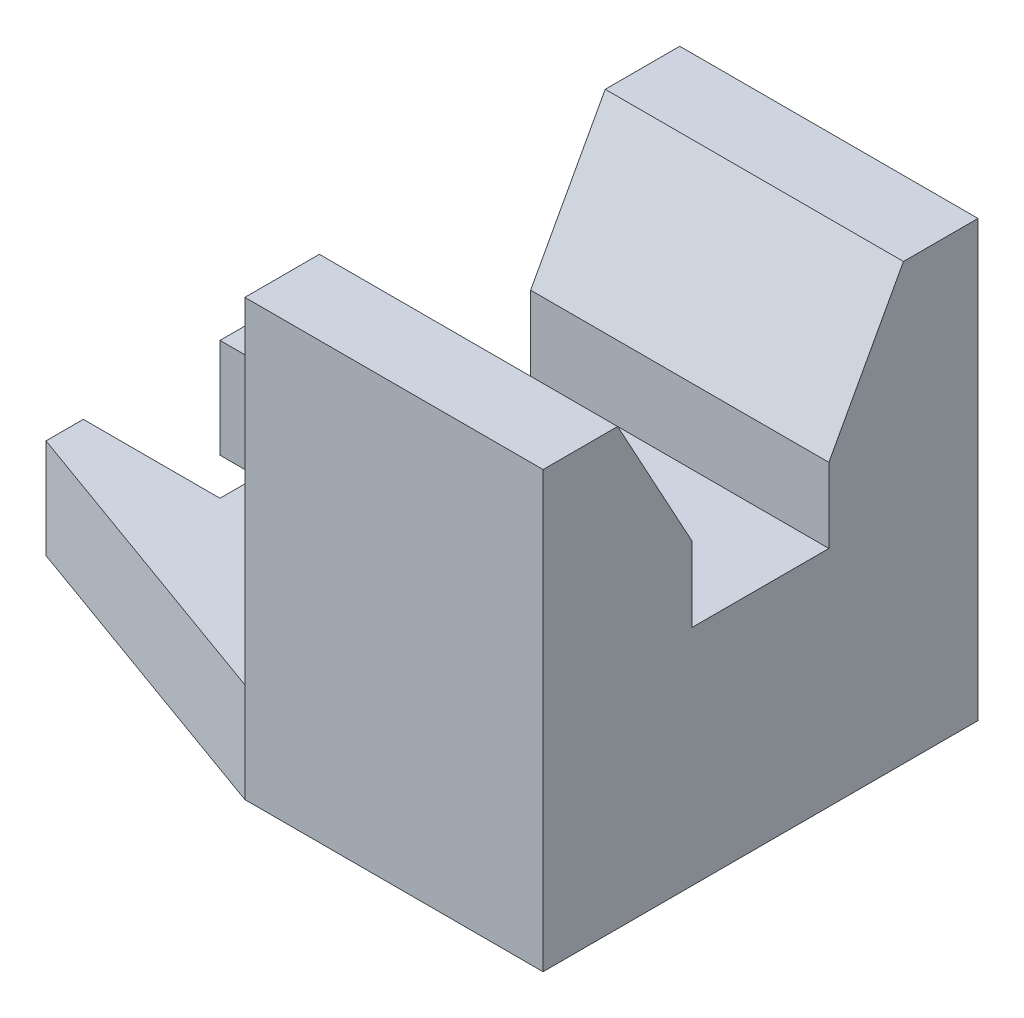
from build123d import *

# Parameters (mm, degrees)
EXTRUDE_2_DEPTH     = 8
SKETCH_5_W          = 24
SKETCH_5_H          = 35
EXTRUDE_3_DEPTH     = 27
CUT_EXTRUDE_1_DEPTH = 27


with BuildPart() as part:
    # 草图4 → 凸台-拉伸2 (new body)
    with BuildSketch(Plane(origin=(0, 0, 0), x_dir=(1, 0, 0), z_dir=(0, 1, 0))):
        Polygon((-12, 17.5), (-37, 8.5), (-37, 5.5), (-26, 5.5), (-26, -5.5), (-37, -5.5), (-37, -8.5), (-12, -17.5), (12, -17.5), (12, 17.5), align=None)
    extrude(amount=EXTRUDE_2_DEPTH)

    # 草图5 → 凸台-拉伸3 (add)
    with BuildSketch(Plane(origin=(0, 8, 0), x_dir=(1, 0, 0), z_dir=(0, 1, 0))):
        Rectangle(SKETCH_5_W, SKETCH_5_H)
    extrude(amount=EXTRUDE_3_DEPTH)

    # 草图6 → 切除-拉伸1 (cut)
    with BuildSketch(Plane.ZY.offset(12)):
        Polygon((-11.5, 35), (-5.5, 24), (-5.5, 18), (5.5, 18), (5.5, 24), (11.5, 35), align=None)
    extrude(amount=-CUT_EXTRUDE_1_DEPTH, mode=Mode.SUBTRACT)


solid = part.part
